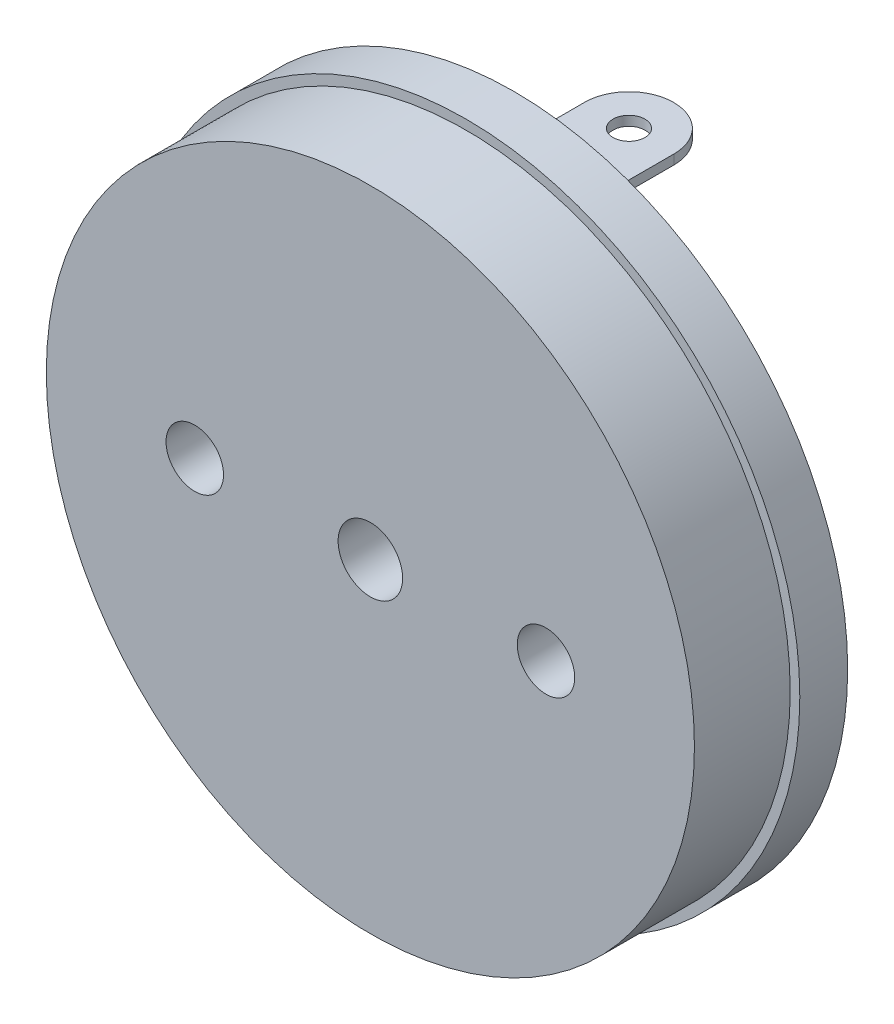
from build123d import *

# Parameters (mm, degrees)
ESQUISSE1_R             = 10.45
BASE_EXTRUSION_DEPTH    = 1.5
ESQUISSE2_R             = 10.15
BOSS_EXTRU_1_DEPTH      = 3
ESQUISSE4_R             = 0.9
ENL_V_MAT_EXTRU_2_DEPTH = 16.448462707
BOSS_EXTRU_3_DEPTH      = 2
ESQUISSE3_R             = 1.01
ENL_V_MAT_EXTRU_1_DEPTH = 17.144813409
ESQUISSE7_W             = 2.8
ESQUISSE7_H             = 0.3
BOSS_EXTRU_4_DEPTH      = 5
CONG_1_R                = 1.39
ESQUISSE8_R             = 0.5
ENL_V_MAT_EXTRU_3_DEPTH = 22.489823173
ESQUISSE9_R             = 1.129243381
ESQUISSE9_W             = 2.119235508
ESQUISSE9_H             = 2.258658896
ENL_V_MAT_EXTRU_4_DEPTH = 1


with BuildPart() as part:
    # Esquisse1 → Base-Extrusion (new body)
    with BuildSketch(Plane.XY):
        Circle(ESQUISSE1_R)
    extrude(amount=BASE_EXTRUSION_DEPTH)

    # Esquisse2 → Boss.-Extru.1 (add)
    with BuildSketch(Plane.XY.offset(1.5)):
        Circle(ESQUISSE2_R)
    extrude(amount=BOSS_EXTRU_1_DEPTH)

    # Esquisse4 (on Front Plane) → Enlèv. mat.-Extru.2 (cut, through all)
    with BuildSketch(Plane.XY):
        with Locations((-5.5, 0)):
            Circle(ESQUISSE4_R)
        with Locations(Location((5.5, 0, 0), (0, 0, 180))):
            Circle(ESQUISSE4_R)
    extrude(amount=ENL_V_MAT_EXTRU_2_DEPTH, mode=Mode.SUBTRACT)

    # Esquisse6 → Boss.-Extru.3 (add)
    with BuildSketch(Plane(origin=(0, 0, 0), x_dir=(-1, 0, 0), z_dir=(0, 0, -1))):
        with BuildLine():
            Line((2.327994108, 2.016641622), (2.327994108, -2.016641622))
            ThreePointArc((2.327994108, -2.016641622), (-3.08, 0), (2.327994108, 2.016641622))
        make_face()
    extrude(amount=BOSS_EXTRU_3_DEPTH)

    # Esquisse3 → Enlèv. mat.-Extru.1 (cut, through all)
    with BuildSketch(Plane.XY.offset(4.5)):
        Circle(ESQUISSE3_R)
    extrude(amount=-ENL_V_MAT_EXTRU_1_DEPTH, mode=Mode.SUBTRACT)

    # Esquisse7 → Boss.-Extru.4 (add)
    with BuildSketch(Plane(origin=(0, 0, 0), x_dir=(-1, 0, 0), z_dir=(0, 0, -1))):
        with Locations((0, 7.5)):
            Rectangle(ESQUISSE7_W, ESQUISSE7_H)
        with Locations((0, -7.5)):
            Rectangle(ESQUISSE7_W, ESQUISSE7_H)
    extrude(amount=BOSS_EXTRU_4_DEPTH)

    # Congé1
    cong_1_edges = [part.edges().sort_by_distance(p)[0] for p in [
        (-1.4, -7.5, -5),
        (1.4, -7.5, -5),
        (1.4, 7.5, -5),
        (-1.4, 7.5, -5),
    ]]
    fillet(cong_1_edges, radius=CONG_1_R)

    # Esquisse8 → Enlèv. mat.-Extru.3 (cut, through all)
    with BuildSketch(Plane(origin=(0, 7.65, 0), x_dir=(-1, 0, 0), z_dir=(0, 1, 0))):
        with Locations(Location((0, -3.6, 0), (0, 0, 90))):
            Circle(ESQUISSE8_R)
    extrude(amount=-ENL_V_MAT_EXTRU_3_DEPTH, mode=Mode.SUBTRACT)

    # Esquisse9 → Enlèv. mat.-Extru.4 (cut)
    with BuildSketch(Plane(origin=(0, 0, 0), x_dir=(-1, 0, 0), z_dir=(0, 0, -1))):
        with Locations((3.625008105, 7.082708144)):
            Circle(ESQUISSE9_R)
        with Locations((-3.875970205, -6.789919028)):
            Rectangle(ESQUISSE9_W, ESQUISSE9_H)
    extrude(amount=-ENL_V_MAT_EXTRU_4_DEPTH, mode=Mode.SUBTRACT)


solid = part.part
